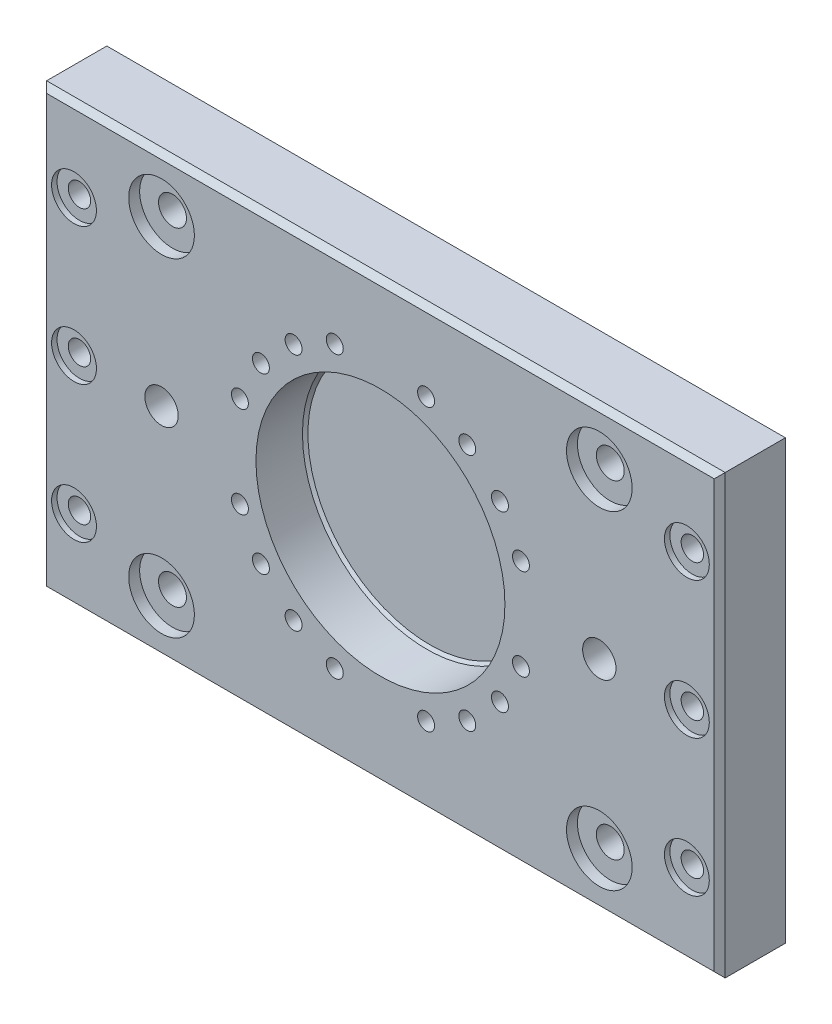
from build123d import *

# Parameters (mm, degrees)
SKETCH_1_W          = 124
SKETCH_1_H          = 80
EXTRUDE_1_DEPTH     = 12
SKETCH_2_R          = 22.75
CUT_EXTRUDE_1_DEPTH = 9
SKETCH_3_R          = 2.55
SKETCH_3_R_2        = 3.05
CUT_EXTRUDE_2_DEPTH = 75.752926364
SKETCH_4_R          = 2.05
CUT_EXTRUDE_3_DEPTH = 12
CHAMFER_1_SIZE      = 0.5
SKETCH_5_R          = 1.55
CUT_EXTRUDE_4_DEPTH = 12
SKETCH_6_R          = 3.25
CUT_EXTRUDE_5_DEPTH = 2.5
SKETCH_7_R          = 6
CUT_EXTRUDE_6_DEPTH = 2
SKETCH_8_R          = 4.1
CUT_EXTRUDE_7_DEPTH = 1
CHAMFER_2_SIZE      = 1


with BuildPart() as part:
    # Эскиз1 → Бобышка-Вытянуть1 (new body)
    with BuildSketch(Plane.XY):
        Rectangle(SKETCH_1_W, SKETCH_1_H)
    extrude(amount=EXTRUDE_1_DEPTH)

    # Эскиз2 → Вырез-Вытянуть1 (cut)
    with BuildSketch(Plane.XY.offset(12)):
        Circle(SKETCH_2_R)
    extrude(amount=-CUT_EXTRUDE_1_DEPTH, mode=Mode.SUBTRACT)

    # Эскиз3 → Вырез-Вытянуть2 (cut, through all)
    with BuildSketch(Plane.XY.offset(12)):
        with Locations((-40, 30)):
            Circle(SKETCH_3_R)
        with Locations((-40, 0)):
            Circle(SKETCH_3_R_2)
        with Locations((-40, -30)):
            Circle(SKETCH_3_R)
        with Locations((40, -30)):
            Circle(SKETCH_3_R)
        with Locations((40, 0)):
            Circle(SKETCH_3_R_2)
        with Locations((40, 30)):
            Circle(SKETCH_3_R)
    extrude(amount=-CUT_EXTRUDE_2_DEPTH, mode=Mode.SUBTRACT)

    # Эскиз4 → Вырез-Вытянуть3 (cut)
    with BuildSketch(Plane.XY.offset(12)):
        with Locations((-56, 25)):
            Circle(SKETCH_4_R)
        with Locations((-56, 0)):
            Circle(SKETCH_4_R)
        with Locations((-56, -25)):
            Circle(SKETCH_4_R)
        with Locations((56, -25)):
            Circle(SKETCH_4_R)
        with Locations((56, 0)):
            Circle(SKETCH_4_R)
        with Locations((56, 25)):
            Circle(SKETCH_4_R)
    extrude(amount=-CUT_EXTRUDE_3_DEPTH, mode=Mode.SUBTRACT)

    # Фаска1
    chamfer_1_edges = [part.edges().sort_by_distance(p)[0] for p in [
        (-22.75, 0, 3),
    ]]
    chamfer(chamfer_1_edges, length=CHAMFER_1_SIZE)

    # Эскиз5 → Вырез-Вытянуть4 (cut)
    with BuildSketch(Plane.XY.offset(12)):
        with Locations((-8.343458848, 25.67852594)):
            Circle(SKETCH_5_R)
        with Locations((8.343458848, 25.67852594)):
            Circle(SKETCH_5_R)
        with Locations((15.870201812, 21.843458848)):
            Circle(SKETCH_5_R)
        with Locations((21.843458848, 15.870201812)):
            Circle(SKETCH_5_R)
        with Locations((25.67852594, 8.343458848)):
            Circle(SKETCH_5_R)
        with Locations((25.67852594, -8.343458848)):
            Circle(SKETCH_5_R)
        with Locations((21.843458848, -15.870201812)):
            Circle(SKETCH_5_R)
        with Locations((15.870201812, -21.843458848)):
            Circle(SKETCH_5_R)
        with Locations((8.343458848, -25.67852594)):
            Circle(SKETCH_5_R)
        with Locations((-8.343458848, -25.67852594)):
            Circle(SKETCH_5_R)
        with Locations((-15.870201812, -21.843458848)):
            Circle(SKETCH_5_R)
        with Locations((-21.843458848, -15.870201812)):
            Circle(SKETCH_5_R)
        with Locations((-25.67852594, -8.343458848)):
            Circle(SKETCH_5_R)
        with Locations((-25.67852594, 8.343458848)):
            Circle(SKETCH_5_R)
        with Locations((-21.843458848, 15.870201812)):
            Circle(SKETCH_5_R)
        with Locations((-15.870201812, 21.843458848)):
            Circle(SKETCH_5_R)
    extrude(amount=-CUT_EXTRUDE_4_DEPTH, mode=Mode.SUBTRACT)

    # Эскиз6 → Вырез-Вытянуть5 (cut)
    with BuildSketch(Plane(origin=(0, 0, 0), x_dir=(-1, 0, 0), z_dir=(0, 0, -1))):
        with Locations((-8.343458848, 25.67852594)):
            Circle(SKETCH_6_R)
        with Locations((8.343458848, 25.67852594)):
            Circle(SKETCH_6_R)
        with Locations((15.870201812, 21.843458848)):
            Circle(SKETCH_6_R)
        with Locations((21.843458848, 15.870201812)):
            Circle(SKETCH_6_R)
        with Locations((25.67852594, 8.343458848)):
            Circle(SKETCH_6_R)
        with Locations((25.67852594, -8.343458848)):
            Circle(SKETCH_6_R)
        with Locations((21.843458848, -15.870201812)):
            Circle(SKETCH_6_R)
        with Locations((15.870201812, -21.843458848)):
            Circle(SKETCH_6_R)
        with Locations((8.343458848, -25.67852594)):
            Circle(SKETCH_6_R)
        with Locations((-8.343458848, -25.67852594)):
            Circle(SKETCH_6_R)
        with Locations((-15.870201812, -21.843458848)):
            Circle(SKETCH_6_R)
        with Locations((-21.843458848, -15.870201812)):
            Circle(SKETCH_6_R)
        with Locations((-25.67852594, -8.343458848)):
            Circle(SKETCH_6_R)
        with Locations((-25.67852594, 8.343458848)):
            Circle(SKETCH_6_R)
        with Locations((-21.843458848, 15.870201812)):
            Circle(SKETCH_6_R)
        with Locations((-15.870201812, 21.843458848)):
            Circle(SKETCH_6_R)
    extrude(amount=-CUT_EXTRUDE_5_DEPTH, mode=Mode.SUBTRACT)

    # Эскиз7 → Вырез-Вытянуть6 (cut)
    with BuildSketch(Plane.XY.offset(12)):
        with Locations((-40, -30)):
            Circle(SKETCH_7_R)
        with Locations((-40, 30)):
            Circle(SKETCH_7_R)
        with Locations((40, 30)):
            Circle(SKETCH_7_R)
        with Locations((40, -30)):
            Circle(SKETCH_7_R)
    extrude(amount=-CUT_EXTRUDE_6_DEPTH, mode=Mode.SUBTRACT)

    # Эскиз8 → Вырез-Вытянуть7 (cut)
    with BuildSketch(Plane.XY.offset(12)):
        with Locations((-56, 25)):
            Circle(SKETCH_8_R)
        with Locations((-56, 0)):
            Circle(SKETCH_8_R)
        with Locations((-56, -25)):
            Circle(SKETCH_8_R)
        with Locations((56, -25)):
            Circle(SKETCH_8_R)
        with Locations((56, 0)):
            Circle(SKETCH_8_R)
        with Locations((56, 25)):
            Circle(SKETCH_8_R)
    extrude(amount=-CUT_EXTRUDE_7_DEPTH, mode=Mode.SUBTRACT)

    # Фаска2
    chamfer_2_edges = [part.edges().sort_by_distance(p)[0] for p in [
        (-62, 0, 12),
        (0, -40, 12),
        (62, 0, 12),
        (0, 40, 12),
    ]]
    chamfer(chamfer_2_edges, length=CHAMFER_2_SIZE)


solid = part.part
